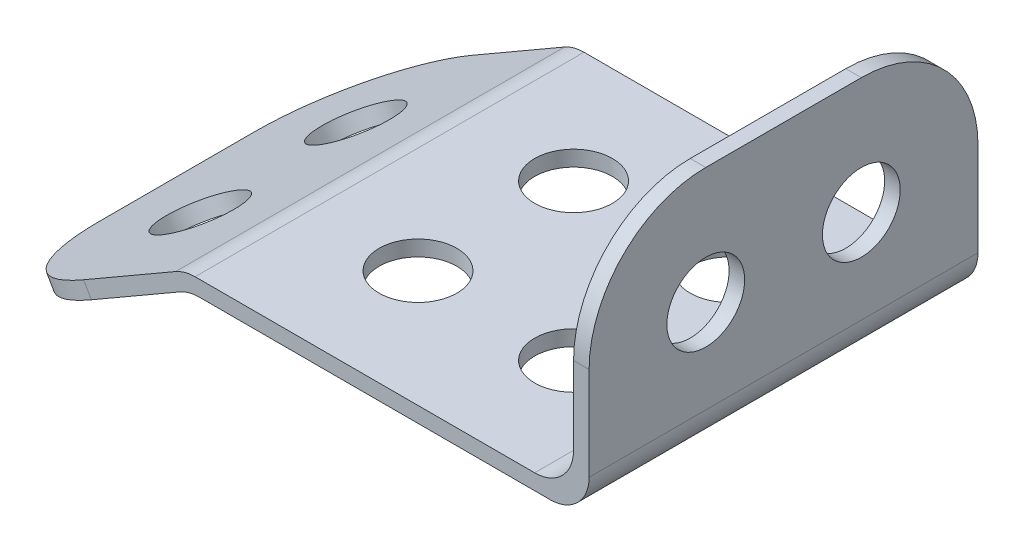
from build123d import *

# Parameters (mm, degrees)
EXTRUDE_THIN1_DEPTH  = 50
FILLET1_R            = 15
CUT_EXTRUDE1_REACH   = 79.453
SKETCH2_R            = 5
LPATTERN1_COUNT      = 2
LPATTERN1_PITCH      = 20
LPATTERN1_COUNT_DIR2 = 2
LPATTERN1_PITCH_DIR2 = 20
CUT_EXTRUDE2_REACH   = 74.528
SKETCH3_R            = 5
SKETCH4_R            = 5
CUT_EXTRUDE3_DEPTH   = 96.776177682
LPATTERN2_COUNT      = 2
LPATTERN2_PITCH      = 20
FILLET2_R            = 5


with BuildPart() as part:
    # Sketch1 → Extrude-Thin1 (new body)
    with BuildSketch(Plane.XY):
        Polygon((25, 30), (25, 0), (-25, 0), (-50.980762114, -15), (-49.980762114, -16.732050808), (-24.464101615, -2), (27, -2), (27, 30), align=None)
    extrude(amount=EXTRUDE_THIN1_DEPTH)

    # Fillet1
    fillet1_edges = [part.edges().sort_by_distance(p)[0] for p in [
        (-50.480762114, -15.866025404, 50),
        (-50.480762114, -15.866025404, 0),
        (26, 30, 50),
        (26, 30, 0),
    ]]
    fillet(fillet1_edges, radius=FILLET1_R)

    # Sketch2 → Cut-Extrude1 (cut, up to next)
    with BuildSketch(Plane(origin=(0, 0, 0), x_dir=(1, 0, 0), z_dir=(0, 1, 0)), mode=Mode.PRIVATE) as cut_extrude1_sk1:
        with Locations(Location((-10, -15, 0), (0, 0, 180))):
            Circle(SKETCH2_R)
    cut_extrude1_tool1 = extrude(cut_extrude1_sk1.sketch, amount=-CUT_EXTRUDE1_REACH, mode=Mode.PRIVATE) & part.part
    cut_extrude1 = cut_extrude1_tool1.solids().sort_by_distance((-10, 0, 15))[0]
    add(cut_extrude1, mode=Mode.SUBTRACT)

    # LPattern1: Cut-Extrude1 2 × 2
    with Locations(*[(j * LPATTERN1_PITCH_DIR2, 0, i * LPATTERN1_PITCH) for i in range(LPATTERN1_COUNT) for j in range(LPATTERN1_COUNT_DIR2) if (i, j) != (0, 0)]):
        add(cut_extrude1, mode=Mode.SUBTRACT)

    # Sketch3 → Cut-Extrude2 (cut, up to next)
    with BuildSketch(Plane(origin=(-6.25, 10.825317547, 0), x_dir=(0.8660254037844379, 0.5000000000000013, 0), z_dir=(-0.5000000000000013, 0.8660254037844379, 0)), mode=Mode.PRIVATE) as cut_extrude2_sk1:
        with Locations(Location((-36.650635095, -15, 0), (0, 0, 180))):
            Circle(SKETCH3_R)
    cut_extrude2_tool1 = extrude(cut_extrude2_sk1.sketch, amount=-CUT_EXTRUDE2_REACH, mode=Mode.PRIVATE) & part.part
    # Sketch3 → Cut-Extrude2 (cut, up to next)
    with BuildSketch(Plane(origin=(-6.25, 10.825317547, 0), x_dir=(0.8660254037844379, 0.5000000000000013, 0), z_dir=(-0.5000000000000013, 0.8660254037844379, 0)), mode=Mode.PRIVATE) as cut_extrude2_sk2:
        with Locations(Location((-36.650635095, -35, 0), (0, 0, 180))):
            Circle(SKETCH3_R)
    cut_extrude2_tool2 = extrude(cut_extrude2_sk2.sketch, amount=-CUT_EXTRUDE2_REACH, mode=Mode.PRIVATE) & part.part
    add(cut_extrude2_tool1.solids().sort_by_distance((-37.990381, -7.5, 15))[0], mode=Mode.SUBTRACT)
    add(cut_extrude2_tool2.solids().sort_by_distance((-37.990381, -7.5, 35))[0], mode=Mode.SUBTRACT)

    # Sketch4 → Cut-Extrude3 (cut, through all)
    with BuildSketch(Plane.ZY.offset(-25)):
        with Locations((15, 15)):
            Circle(SKETCH4_R)
    cut_extrude3 = extrude(amount=-CUT_EXTRUDE3_DEPTH, mode=Mode.SUBTRACT)

    # LPattern2: Cut-Extrude3 ×2
    with Locations(*[(0, 0, i * LPATTERN2_PITCH) for i in range(1, LPATTERN2_COUNT)]):
        add(cut_extrude3, mode=Mode.SUBTRACT)

    # Fillet2
    fillet2_edges = [part.edges().sort_by_distance(p)[0] for p in [
        (27, -2, 25),
        (-24.464101615, -2, 25),
        (-25, 0, 25),
        (25, 0, 25),
    ]]
    fillet(fillet2_edges, radius=FILLET2_R)


solid = part.part
